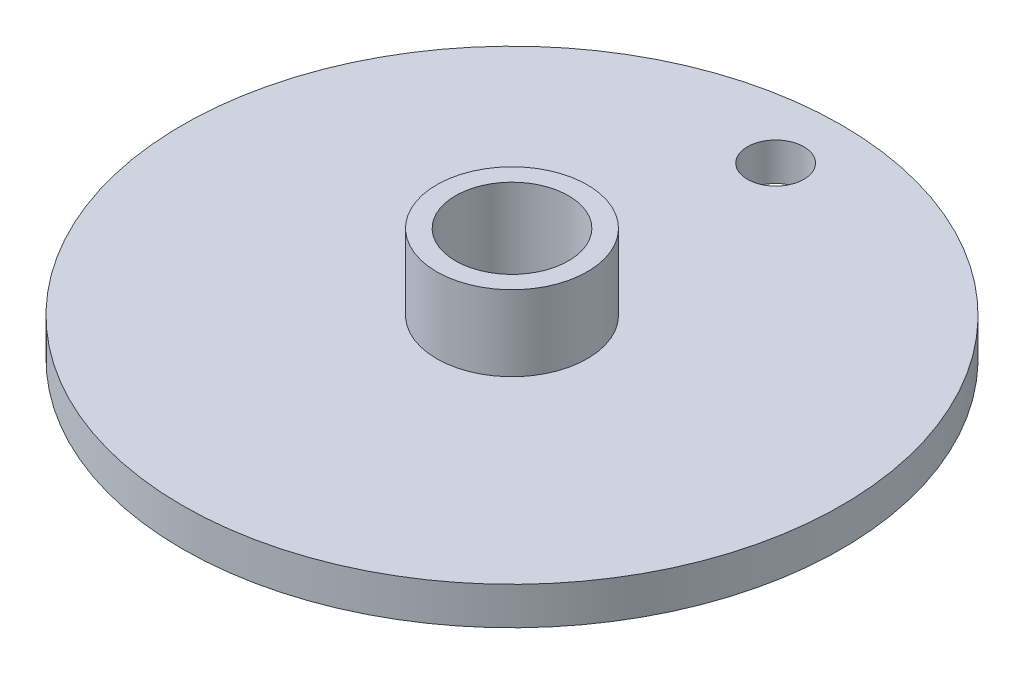
from build123d import *

# Parameters (mm, degrees)
SKETCH1_R                   = 17.5
SKETCH1_R_2                 = 3
BOSS_EXTRUDE1_DEPTH         = 2
IZIM1_R                     = 4
IZIM1_R_2                   = 3
Y_KSEKLIK_EKSTR_ZYON1_DEPTH = 4
CUT_EXTRUDE1_REACH          = 27.466
SKETCH2_R                   = 1.5


with BuildPart() as part:
    # Sketch1 → Boss-Extrude1 (new body)
    with BuildSketch(Plane(origin=(0, 0, 0), x_dir=(1, 0, 0), z_dir=(0, 1, 0))):
        with Locations(Location((0, 0, 0), (0, 0, 270))):
            Circle(SKETCH1_R)
        with Locations(Location((0, 0, 0), (0, 0, 270))):
            Circle(SKETCH1_R_2, mode=Mode.SUBTRACT)
    extrude(amount=BOSS_EXTRUDE1_DEPTH)

    # Çizim1 → Yükseklik-Ekstrüzyon1 (add)
    with BuildSketch(Plane(origin=(0, 2, 0), x_dir=(1, 0, 0), z_dir=(0, 1, 0))):
        with Locations(Location((0, 0, 0), (0, 0, 270))):
            Circle(IZIM1_R)
        with Locations(Location((0, 0, 0), (0, 0, 270))):
            Circle(IZIM1_R_2, mode=Mode.SUBTRACT)
    extrude(amount=Y_KSEKLIK_EKSTR_ZYON1_DEPTH)

    # Sketch2 → Cut-Extrude1 (cut, up to next)
    with BuildSketch(Plane.XZ, mode=Mode.PRIVATE) as cut_extrude1_sk1:
        with Locations(Location((0, -14, 0), (0, 0, 270))):
            Circle(SKETCH2_R)
    cut_extrude1_tool1 = extrude(cut_extrude1_sk1.sketch, amount=-CUT_EXTRUDE1_REACH, mode=Mode.PRIVATE) & part.part
    add(cut_extrude1_tool1.solids().sort_by_distance((0, 0, -14))[0], mode=Mode.SUBTRACT)


solid = part.part
